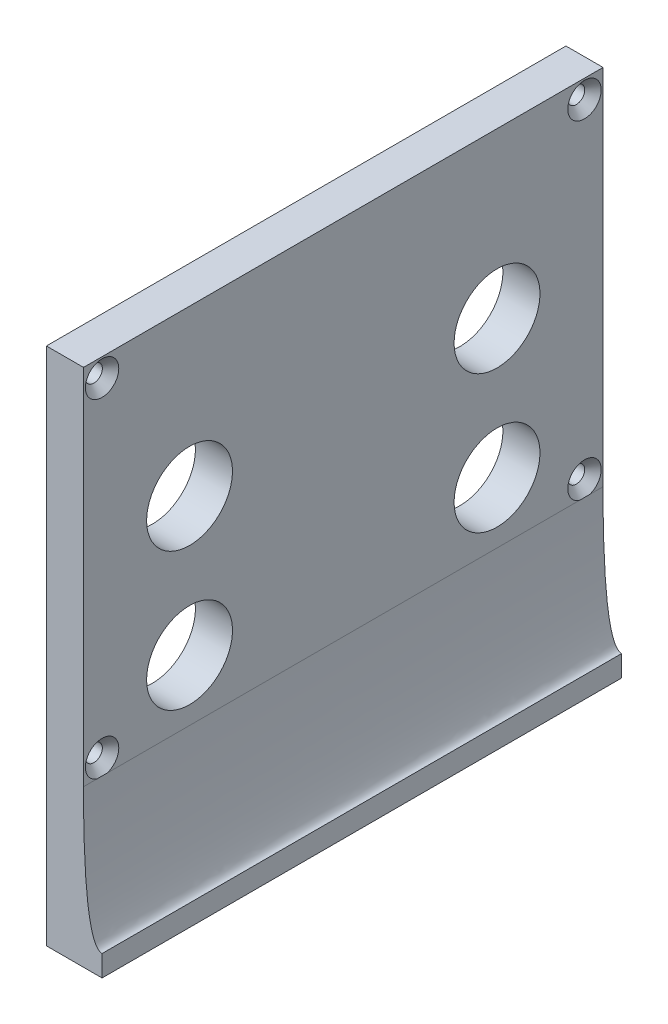
from build123d import *

# Parameters (mm, degrees)
BOSS_EXTRUDE1_DEPTH                            = 98
SKETCH2_R                                      = 8.1
CUT_EXTRUDE1_DEPTH                             = 114.573245575
CSK_FOR_M3_FLAT_HEAD_MACHINE_SCREW2_AT_2_COUNT = 2
CSK_FOR_M3_FLAT_HEAD_MACHINE_SCREW2_AT_2_PITCH = 62
CSK_FOR_M3_FLAT_HEAD_MACHINE_SCREW2_AT_3_COUNT = 2
CSK_FOR_M3_FLAT_HEAD_MACHINE_SCREW2_AT_3_PITCH = 110.113577728
CSK_FOR_M3_FLAT_HEAD_MACHINE_SCREW2_AT_4_COUNT = 2
CSK_FOR_M3_FLAT_HEAD_MACHINE_SCREW2_AT_4_PITCH = 91
SKETCH9_W                                      = 29.5
SKETCH9_H                                      = 7
CUT_EXTRUDE2_DEPTH                             = 2.5


with BuildPart() as part:
    # Sketch1 → Boss-Extrude1 (new body)
    with BuildSketch(Plane.XY):
        with BuildLine():
            Line((-46.838690812, 41.567455511), (-46.838690812, -56.432544489))
            Line((-46.838690812, -56.432544489), (-36.338690812, -56.432544489))
            Line((-36.338690812, -56.432544489), (-36.338690812, -52.432544489))
            add(Edge.make_bspline(
                [(-39.838690812, -26.932544489), (-39.838690812, -52.432544489), (-36.338690812, -52.432544489)],
                knots=[0, 0, 0, 1, 1, 1], degree=2))
            Line((-39.838690812, -26.932544489), (-39.838690812, 41.567455511))
            Line((-39.838690812, 41.567455511), (-46.838690812, 41.567455511))
        make_face()
    extrude(amount=BOSS_EXTRUDE1_DEPTH)

    # Sketch2 → Cut-Extrude1 (cut, through all)
    with BuildSketch(Plane.ZY.offset(46.838690812)):
        with Locations((20, 10.567455511)):
            Circle(SKETCH2_R)
        with Locations((78, 10.567455511)):
            Circle(SKETCH2_R)
        with Locations((78, -15.432544489)):
            Circle(SKETCH2_R)
        with Locations((20, -15.432544489)):
            Circle(SKETCH2_R)
    extrude(amount=-CUT_EXTRUDE1_DEPTH, mode=Mode.SUBTRACT)

    # Sketch8 → CSK for M3 Flat Head Machine Screw2 (revolve, cut)
    with BuildSketch(Plane(origin=(-39.838690812, 38.067455511, 94.5), x_dir=(0, 0, -1), z_dir=(0, 1, 0))):
        Polygon((0, 0), (0, 10.96137699), (1.6, 10), (1.6, 1.55), (3.15, 0), align=None)
    csk_for_m3_flat_head_machine_screw2 = revolve(axis=Axis((-33.488690812, 38.067455511, 94.5), (-1, 0, 0)), mode=Mode.SUBTRACT)

    # CSK for M3 Flat Head Machine Screw2 at 2: CSK for M3 Flat Head Machine Screw2 ×2
    with Locations(*[(0, -i * CSK_FOR_M3_FLAT_HEAD_MACHINE_SCREW2_AT_2_PITCH, 0) for i in range(1, CSK_FOR_M3_FLAT_HEAD_MACHINE_SCREW2_AT_2_COUNT)]):
        add(csk_for_m3_flat_head_machine_screw2, mode=Mode.SUBTRACT)

    # CSK for M3 Flat Head Machine Screw2 at 3: CSK for M3 Flat Head Machine Screw2 ×2
    with Locations(*[Vector(0, -0.5630549953912599, -0.8264194287194296) * (i * CSK_FOR_M3_FLAT_HEAD_MACHINE_SCREW2_AT_3_PITCH) for i in range(1, CSK_FOR_M3_FLAT_HEAD_MACHINE_SCREW2_AT_3_COUNT)]):
        add(csk_for_m3_flat_head_machine_screw2, mode=Mode.SUBTRACT)

    # CSK for M3 Flat Head Machine Screw2 at 4: CSK for M3 Flat Head Machine Screw2 ×2
    with Locations(*[(0, 0, -i * CSK_FOR_M3_FLAT_HEAD_MACHINE_SCREW2_AT_4_PITCH) for i in range(1, CSK_FOR_M3_FLAT_HEAD_MACHINE_SCREW2_AT_4_COUNT)]):
        add(csk_for_m3_flat_head_machine_screw2, mode=Mode.SUBTRACT)

    # Sketch9 → Cut-Extrude2 (cut)
    with BuildSketch(Plane.ZY.offset(46.838690812)):
        with Locations((54.25, 36.567455511)):
            Rectangle(SKETCH9_W, SKETCH9_H)
    extrude(amount=-CUT_EXTRUDE2_DEPTH, mode=Mode.SUBTRACT)


solid = part.part
